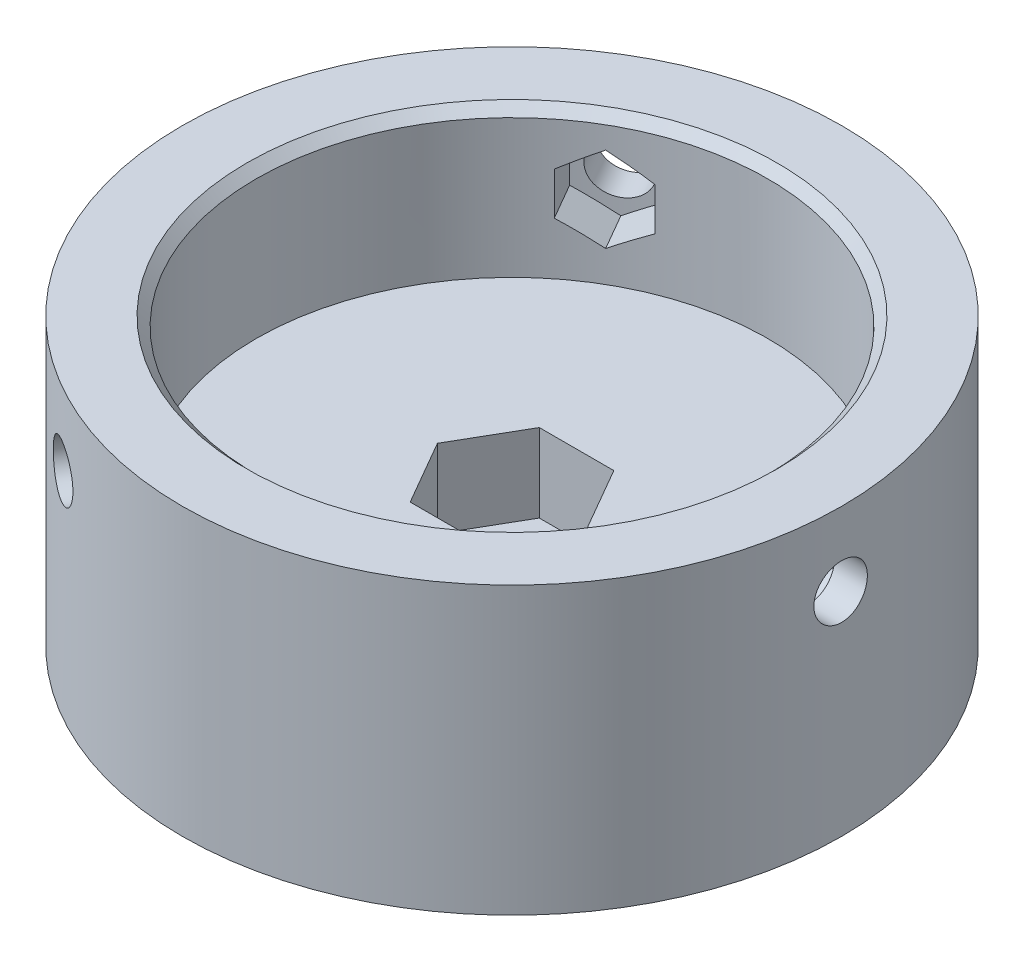
from build123d import *

# Parameters (mm, degrees)
CUT_EXTRUDE_1_REACH      = 61.305
CUT_EXTRUDE_1_END_RADIUS = 32.25
SKETCH_3_R               = 2.9
CUT_EXTRUDE_2_DEPTH      = 60.30535389
PATTERN_CIRCULAR_1_COUNT = 3
CUT_EXTRUDE_5_DEPTH      = 8.5
HOLE_WIZARD_3_8_1_D      = 10.31748
HOLE_WIZARD_3_8_1_DEPTH  = 10
HOLE_WIZARD_3_8_1_TIP    = 3.09968371
CHAMFER_1_SIZE           = 1


with BuildPart() as part:
    # 草圖1 → 旋轉1 (revolve)
    with BuildSketch(Plane.XY, mode=Mode.PRIVATE) as revolve_1_sk:
        Polygon((0, 15), (0, 0), (35.75, 0), (35.75, 31), (27.75, 31), (27.75, 15), align=None)
    revolve(revolve_1_sk.sketch.rotate(Axis((0, 38.135683761, 0), (0, -1, 0)), 180), axis=Axis((0, 38.135683761, 0), (0, -1, 0)))

    # 除料-伸長1: up to this cylinder (the profile starts inside it)
    cut_extrude_1_end = Plane(origin=(0, 23, 0), z_dir=(0, 1, 0)) * Cylinder(CUT_EXTRUDE_1_END_RADIUS, 188.11, mode=Mode.PRIVATE)
    # 草圖2 → 除料-伸長1 (cut, up to the surface)
    with BuildSketch(Plane(origin=(0, 0, 0), x_dir=(0, 0, -1), z_dir=(1, 0, 0)), mode=Mode.PRIVATE) as cut_extrude_1_sk1:
        Polygon((0, 27.618802154), (-4, 25.309401077), (-4, 20.690598923), (0, 18.381197846), (4, 20.690598923), (4, 25.309401077), align=None)
    cut_extrude_1_tool1 = extrude(cut_extrude_1_sk1.sketch, amount=CUT_EXTRUDE_1_REACH, mode=Mode.PRIVATE) & cut_extrude_1_end
    cut_extrude_1 = cut_extrude_1_tool1.solids().sort_by_distance((0, 23, 0))[0]
    add(cut_extrude_1, mode=Mode.SUBTRACT)

    # 草圖3 → 除料-伸長2 (cut, through all)
    with BuildSketch(Plane(origin=(0, 0, 0), x_dir=(0, 0, -1), z_dir=(1, 0, 0))):
        with Locations(Location((0, 23, 0), (0, 0, 180))):
            Circle(SKETCH_3_R)
    cut_extrude_2 = extrude(amount=CUT_EXTRUDE_2_DEPTH, mode=Mode.SUBTRACT)

    # 環狀複製排列1: 除料-伸長1, 除料-伸長2 ×3 about axis
    pattern_circular_1_axis = Axis((0, 0, 0), (0, 1, 0))
    add([cut_extrude_1.rotate(pattern_circular_1_axis, i * 360 / PATTERN_CIRCULAR_1_COUNT) for i in range(1, PATTERN_CIRCULAR_1_COUNT)], mode=Mode.SUBTRACT)
    add([cut_extrude_2.rotate(pattern_circular_1_axis, i * 360 / PATTERN_CIRCULAR_1_COUNT) for i in range(1, PATTERN_CIRCULAR_1_COUNT)], mode=Mode.SUBTRACT)

    # 草圖6 → 除料-伸長5 (cut)
    with BuildSketch(Plane(origin=(0, 15, 0), x_dir=(1, 0, 0), z_dir=(0, 1, 0))):
        Polygon((8.082903769, 0), (4.041451884, 7), (-4.041451884, 7), (-8.082903769, 0), (-4.041451884, -7), (4.041451884, -7), align=None)
    extrude(amount=-CUT_EXTRUDE_5_DEPTH, mode=Mode.SUBTRACT)

    # 3/8 餘隙孔1
    with Locations(Plane(origin=(0, 0, 0), x_dir=(-1, 0, 0), z_dir=(0, -1, 0))):
        with Locations((0, 0)):
            Hole(HOLE_WIZARD_3_8_1_D / 2, depth=HOLE_WIZARD_3_8_1_DEPTH)
            with Locations((0, 0, -(HOLE_WIZARD_3_8_1_DEPTH + HOLE_WIZARD_3_8_1_TIP / 2))):  # 118° drill point
                Cone(0, HOLE_WIZARD_3_8_1_D / 2, HOLE_WIZARD_3_8_1_TIP, mode=Mode.SUBTRACT)

    # 導角1
    chamfer_1_edges = [part.edges().sort_by_distance(p)[0] for p in [
        (27.75, 31, 0),
    ]]
    chamfer(chamfer_1_edges, length=CHAMFER_1_SIZE)


solid = part.part
